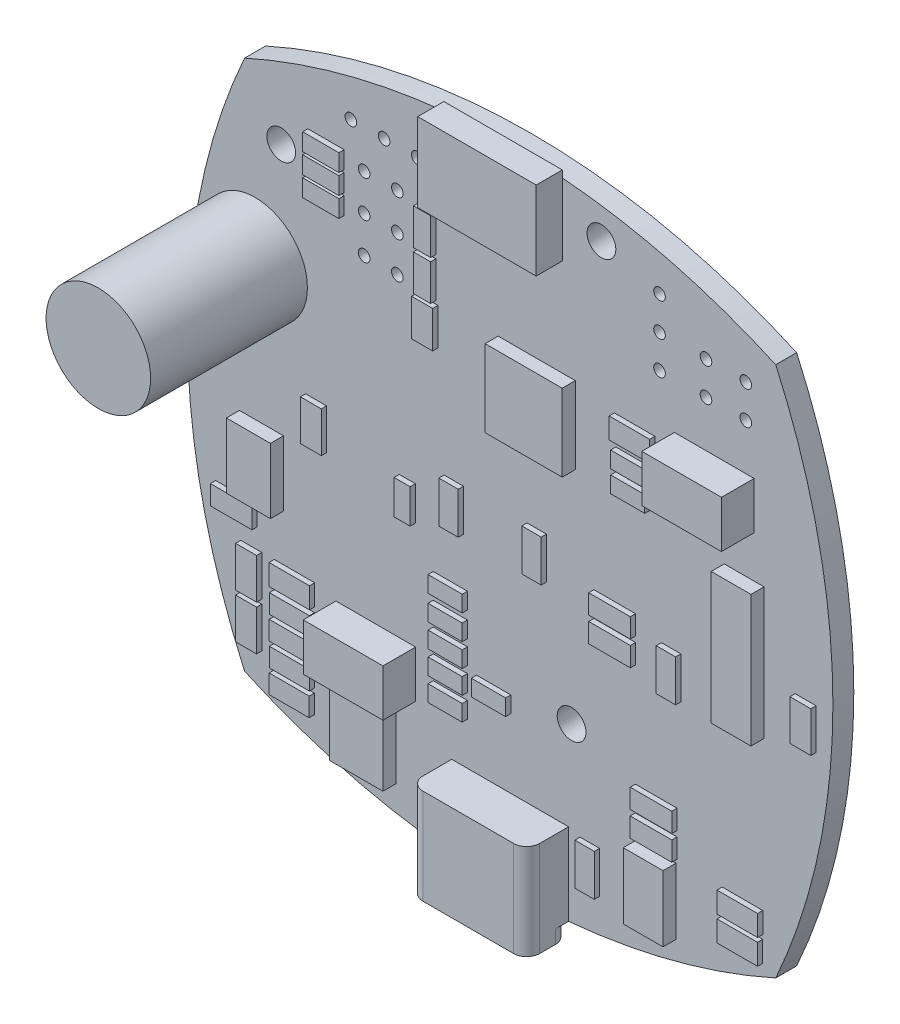
from build123d import *

# Parameters (mm, degrees)
EXTRUDE_1_DEPTH     = 1.6
SKETCH_5_R          = 3.99999962
EXTRUDE_2_DEPTH     = 12
SKETCH_6_W          = 8.94
SKETCH_6_H          = 7.3
EXTRUDE_3_DEPTH     = 3.21
FILLET_1_R          = 1
SKETCH_7_W          = 3.3712404
SKETCH_7_H          = 4.9899824
SKETCH_7_W_2        = 4.100068
SKETCH_7_H_2        = 5.10032
SKETCH_7_W_3        = 3.0428184
SKETCH_7_H_3        = 5.0524156
SKETCH_7_W_4        = 5.899912
SKETCH_7_H_4        = 5.899912
SKETCH_7_H_5        = 10.0524056
EXTRUDE_4_DEPTH     = 1
SKETCH_8_W          = 9.0672412
SKETCH_8_H          = 6.0365132
EXTRUDE_5_DEPTH     = 2
SKETCH_9_W          = 3.100578
SKETCH_9_H          = 1.5949422
SKETCH_9_W_2        = 3.0599888
SKETCH_9_H_2        = 1.4399768
SKETCH_9_W_3        = 1.605153
SKETCH_9_H_3        = 3.100578
SKETCH_9_W_4        = 2.7701748
SKETCH_9_H_4        = 1.3212064
EXTRUDE_6_DEPTH     = 0.4
SKETCH_10_W         = 1.3212064
SKETCH_10_H         = 2.7701748
SKETCH_10_W_2       = 1.612801074
SKETCH_10_H_2       = 2.822401878
SKETCH_10_W_3       = 2.614030256
SKETCH_10_H_3       = 1.243979656
SKETCH_10_W_4       = 3.182854307
SKETCH_10_H_4       = 1.482883107
SKETCH_10_W_5       = 1.482883107
SKETCH_10_H_5       = 3.182854307
SKETCH_10_W_6       = 1.232346456
SKETCH_10_H_6       = 2.614030258
EXTRUDE_7_DEPTH     = 0.4
SKETCH_11_W         = 6.0999878
SKETCH_11_H         = 3.6000182
EXTRUDE_8_DEPTH     = 2.5
SKETCH_12_R         = 1.0999978
CUT_EXTRUDE_1_DEPTH = 2.5
SKETCH_13_R         = 0.4445
CUT_EXTRUDE_2_DEPTH = 10


with BuildPart() as part:
    # 草图4 → 凸台-拉伸1 (new body)
    with BuildSketch(Plane.XY):
        with BuildLine():
            ThreePointArc((20.325028692, 20.325028692), (0, 24.7), (-20.325028692, 20.325028692))
            ThreePointArc((-20.325028692, 20.325028692), (-24.7, 0), (-20.325028692, -20.325028692))
            ThreePointArc((-20.325028692, -20.325028692), (0, -24.7), (20.325028692, -20.325028692))
            ThreePointArc((20.325028692, -20.325028692), (24.7, 0), (20.325028692, 20.325028692))
        make_face()
    extrude(amount=EXTRUDE_1_DEPTH)

    # 草图5 → 凸台-拉伸2 (add)
    with BuildSketch(Plane.XY.offset(1.6)):
        with Locations((-19.5199, 7.493658447)):
            Circle(SKETCH_5_R)
    extrude(amount=EXTRUDE_2_DEPTH)

    # 草图6 → 凸台-拉伸3 (add)
    with BuildSketch(Plane.XY.offset(1.6)):
        with Locations((0, -21.8770254)):
            Rectangle(SKETCH_6_W, SKETCH_6_H)
    extrude(amount=EXTRUDE_3_DEPTH)

    # 圆角1
    fillet_1_edges = [part.edges().sort_by_distance(p)[0] for p in [
        (4.47, -25.012186953, 1.6),
        (4.47, -21.8770254, 4.81),
        (-4.47, -25.012186953, 1.6),
        (-4.47, -21.8770254, 4.81),
    ]]
    fillet(fillet_1_edges, radius=FILLET_1_R)

    # 草图7 → 凸台-拉伸4 (add)
    with BuildSketch(Plane.XY.offset(1.6)):
        with Locations((-19.0356236, -5.7200038)):
            Rectangle(SKETCH_7_W, SKETCH_7_H)
        with Locations((-10.795, -19.431)):
            Rectangle(SKETCH_7_W_2, SKETCH_7_H_2)
        with Locations((11.176, -19.05)):
            Rectangle(SKETCH_7_W_3, SKETCH_7_H_3)
        with Locations((2.032, 8.6487)):
            Rectangle(SKETCH_7_W_4, SKETCH_7_H_4)
        with Locations((17.907, 0.127)):
            Rectangle(SKETCH_7_W_3, SKETCH_7_H_5)
    extrude(amount=EXTRUDE_4_DEPTH)

    # 草图8 → 凸台-拉伸5 (add)
    with BuildSketch(Plane.XY.offset(1.6)):
        with Locations((-0.5423154, 22.0517466)):
            Rectangle(SKETCH_8_W, SKETCH_8_H)
    extrude(amount=EXTRUDE_5_DEPTH)

    # 草图9 → 凸台-拉伸6 (add)
    with BuildSketch(Plane.XY.offset(1.6)):
        with Locations((-16.5096698, -12.5704473)):
            Rectangle(SKETCH_9_W, SKETCH_9_H)
        with Locations((-16.4999924, -14.478)):
            Rectangle(SKETCH_9_W_2, SKETCH_9_H_2)
        with Locations((-16.5200076, -16.256)):
            Rectangle(SKETCH_9_W_2, SKETCH_9_H_2)
        with Locations((-16.4999924, -18.034)):
            Rectangle(SKETCH_9_W_2, SKETCH_9_H_2)
        with Locations((-16.5200076, -19.812)):
            Rectangle(SKETCH_9_W_2, SKETCH_9_H_2)
        with Locations((-19.8145527, -13.3346698)):
            Rectangle(SKETCH_9_W_3, SKETCH_9_H_3)
        with Locations((-19.8145527, -16.7636698)):
            Rectangle(SKETCH_9_W_3, SKETCH_9_H_3)
        with Locations((17.7803302, -17.1424473)):
            Rectangle(SKETCH_9_W, SKETCH_9_H)
        with Locations((17.7796698, -19.0525527)):
            Rectangle(SKETCH_9_W, SKETCH_9_H)
        with Locations((22.6085527, -2.2863302)):
            Rectangle(SKETCH_9_W_3, SKETCH_9_H_3)
        with Locations((-14.8564473, -1.1433302)):
            Rectangle(SKETCH_9_W_3, SKETCH_9_H_3)
        with Locations((-14.097, 17.399)):
            Rectangle(SKETCH_9_W_4, SKETCH_9_H_4)
        with Locations((-14.097, 15.875)):
            Rectangle(SKETCH_9_W_4, SKETCH_9_H_4)
        with Locations((-14.097, 14.351)):
            Rectangle(SKETCH_9_W_4, SKETCH_9_H_4)
        with Locations((9.5246698, 10.1574473)):
            Rectangle(SKETCH_9_W, SKETCH_9_H)
    extrude(amount=EXTRUDE_6_DEPTH)

    # 草图10 → 凸台-拉伸7 (add)
    with BuildSketch(Plane.XY.offset(1.6)):
        with Locations((-6.35, 16.002)):
            Rectangle(SKETCH_10_W, SKETCH_10_H)
        with Locations((-6.35, 12.954)):
            Rectangle(SKETCH_10_W, SKETCH_10_H)
        with Locations((-6.338229758, 9.916049647)):
            Rectangle(SKETCH_10_W_2, SKETCH_10_H_2)
        with Locations((-4.579747, -7.1092949)):
            Rectangle(SKETCH_10_W_3, SKETCH_10_H_3)
        with Locations((-4.579747, -9.0142949)):
            Rectangle(SKETCH_10_W_3, SKETCH_10_H_3)
        with Locations((-4.579747, -10.7922949)):
            Rectangle(SKETCH_10_W_3, SKETCH_10_H_3)
        with Locations((-4.579747, -12.5702949)):
            Rectangle(SKETCH_10_W_3, SKETCH_10_H_3)
        with Locations((-4.579747, -14.3482949)):
            Rectangle(SKETCH_10_W_3, SKETCH_10_H_3)
        with Locations((-1.262253, -12.3217051)):
            Rectangle(SKETCH_10_W_3, SKETCH_10_H_3)
        with Locations((11.17600372, -13.58900372)):
            Rectangle(SKETCH_10_W_4, SKETCH_10_H_4)
        with Locations((11.175996281, -15.493996281)):
            Rectangle(SKETCH_10_W_4, SKETCH_10_H_4)
        with Locations((8.000996281, -2.285996281)):
            Rectangle(SKETCH_10_W_4, SKETCH_10_H_4)
        with Locations((8.000996281, -4.190996281)):
            Rectangle(SKETCH_10_W_4, SKETCH_10_H_4)
        with Locations((12.319003719, -4.06400372)):
            Rectangle(SKETCH_10_W_5, SKETCH_10_H_5)
        with Locations((-20.954996281, -9.52500372)):
            Rectangle(SKETCH_10_W_4, SKETCH_10_H_4)
        with Locations((-5.9717051, -22.232747)):
            Rectangle(SKETCH_10_W_6, SKETCH_10_H_6)
        with Locations((6.09599628, -20.065996281)):
            Rectangle(SKETCH_10_W_5, SKETCH_10_H_5)
        with Locations((-4.317996281, -1.27000372)):
            Rectangle(SKETCH_10_W_5, SKETCH_10_H_5)
        with Locations((-7.8712949, -2.659253)):
            Rectangle(SKETCH_10_W_6, SKETCH_10_H_6)
        with Locations((2.031996281, -1.269996281)):
            Rectangle(SKETCH_10_W_5, SKETCH_10_H_5)
        with Locations((9.390253, 8.1307051)):
            Rectangle(SKETCH_10_W_3, SKETCH_10_H_3)
        with Locations((9.390253, 6.4797051)):
            Rectangle(SKETCH_10_W_3, SKETCH_10_H_3)
    extrude(amount=EXTRUDE_7_DEPTH)

    # 草图11 → 凸台-拉伸8 (add)
    with BuildSketch(Plane.XY.offset(1.6)):
        with Locations((-10.2869873, -13.9700127)):
            Rectangle(SKETCH_11_W, SKETCH_11_H)
        with Locations((15.6209873, 10.1600127)):
            Rectangle(SKETCH_11_W, SKETCH_11_H)
    extrude(amount=EXTRUDE_8_DEPTH)

    # 草图12 → 切除-拉伸1 (cut)
    with BuildSketch(Plane.XY.offset(1.6)):
        with Locations((-17.526, 16.002)):
            Circle(SKETCH_12_R)
        with Locations((6.985, 21.844)):
            Circle(SKETCH_12_R)
        with Locations((4.699, -11.303)):
            Circle(SKETCH_12_R)
    extrude(amount=-CUT_EXTRUDE_1_DEPTH, mode=Mode.SUBTRACT)

    # 草图13 → 切除-拉伸2 (cut)
    with BuildSketch(Plane.XY.offset(1.6)):
        with Locations((-12.192, 20.32)):
            Circle(SKETCH_13_R)
        with Locations((-9.652, 20.32)):
            Circle(SKETCH_13_R)
        with Locations((-7.112, 20.32)):
            Circle(SKETCH_13_R)
        with Locations((-11.176, 17.399)):
            Circle(SKETCH_13_R)
        with Locations((-8.636, 17.399)):
            Circle(SKETCH_13_R)
        with Locations((-11.176, 14.605)):
            Circle(SKETCH_13_R)
        with Locations((-8.636, 14.605)):
            Circle(SKETCH_13_R)
        with Locations((-11.176, 11.811)):
            Circle(SKETCH_13_R)
        with Locations((-8.636, 11.811)):
            Circle(SKETCH_13_R)
        with Locations((11.43, 20.574)):
            Circle(SKETCH_13_R)
        with Locations((11.43, 18.034)):
            Circle(SKETCH_13_R)
        with Locations((11.43, 15.494)):
            Circle(SKETCH_13_R)
        with Locations((14.986, 18.034)):
            Circle(SKETCH_13_R)
        with Locations((14.986, 15.494)):
            Circle(SKETCH_13_R)
        with Locations((18.034, 18.034)):
            Circle(SKETCH_13_R)
        with Locations((18.034, 15.494)):
            Circle(SKETCH_13_R)
    extrude(amount=-CUT_EXTRUDE_2_DEPTH, mode=Mode.SUBTRACT)


solid = part.part
